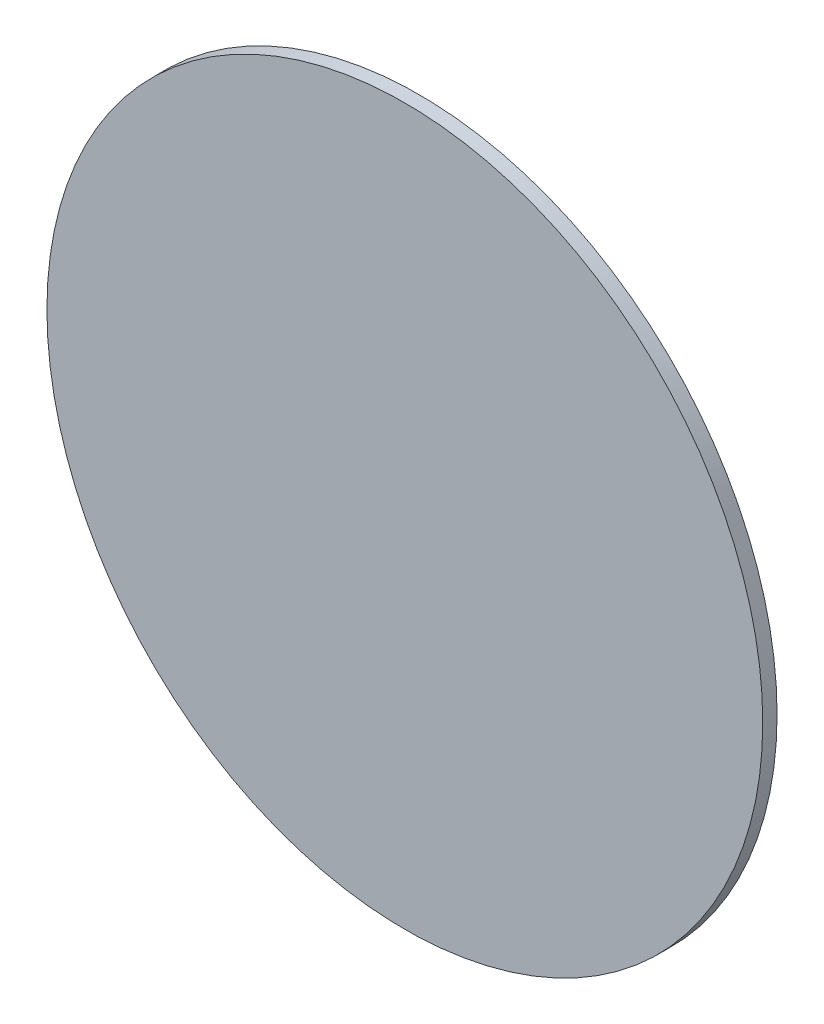
from build123d import *

# Parameters (mm, degrees)
ESQUISSE1_R        = 11.5
BOSS_EXTRU_1_DEPTH = 6
ESQUISSE2_R        = 25
ESQUISSE2_R_2      = 7.5
BOSS_EXTRU_2_DEPTH = 1


with BuildPart() as part:
    # Esquisse1 → Boss.-Extru.1 (new body)
    with BuildSketch(Plane.XY):
        Circle(ESQUISSE1_R)
    extrude(amount=BOSS_EXTRU_1_DEPTH)

    # Esquisse2 → Boss.-Extru.2 (add)
    with BuildSketch(Plane.XY.offset(6)):
        Circle(ESQUISSE2_R)
        Circle(ESQUISSE2_R_2, mode=Mode.SUBTRACT)
    extrude(amount=-BOSS_EXTRU_2_DEPTH)


solid = part.part
